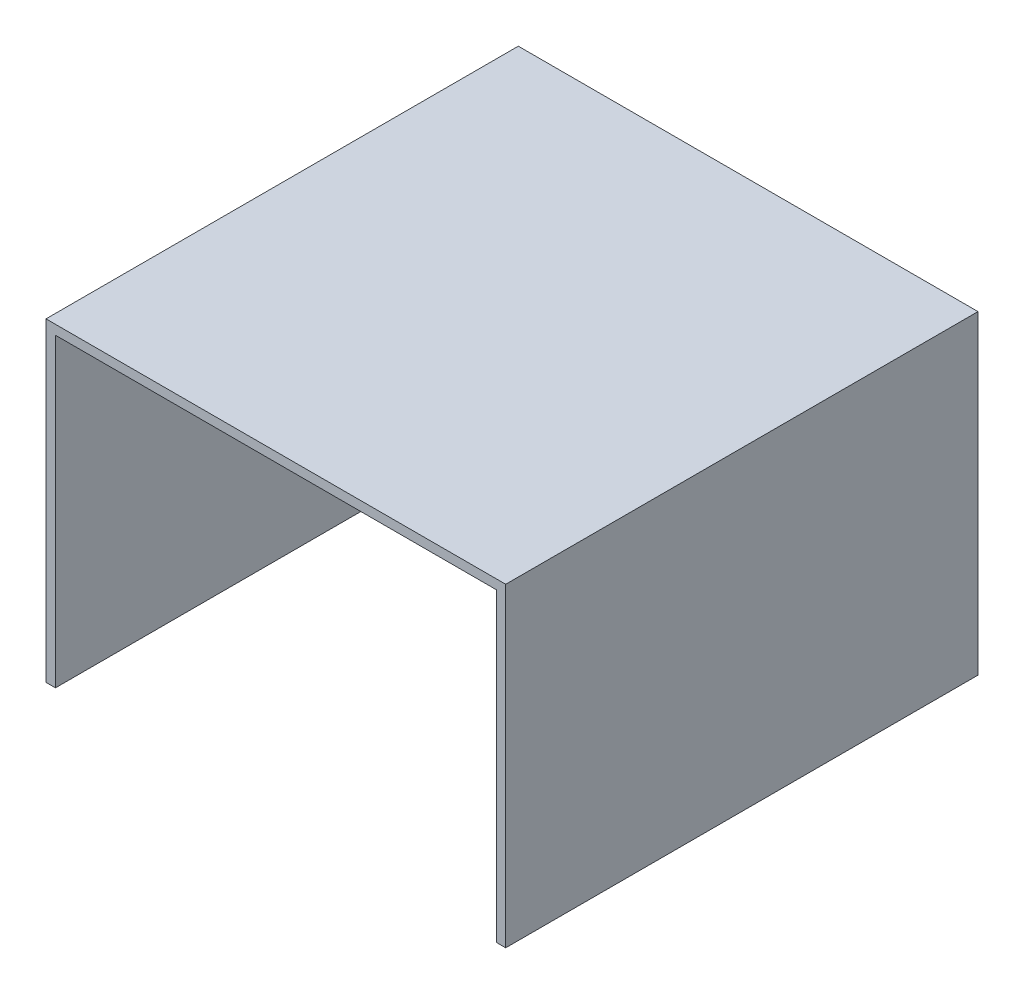
from build123d import *

# Parameters (mm, degrees)
EXTRUDE_2_DEPTH = 75


with BuildPart() as part:
    # 草图1 → 凸台-拉伸2 (new body)
    with BuildSketch(Plane.XY):
        Polygon((36.5, 25), (-36.5, 25), (-36.5, -25), (-35, -25), (-35, -23.5), (-35, 23.5), (35, 23.5), (35, -23.5), (35, -25), (36.5, -25), align=None)
    extrude(amount=EXTRUDE_2_DEPTH)


solid = part.part
